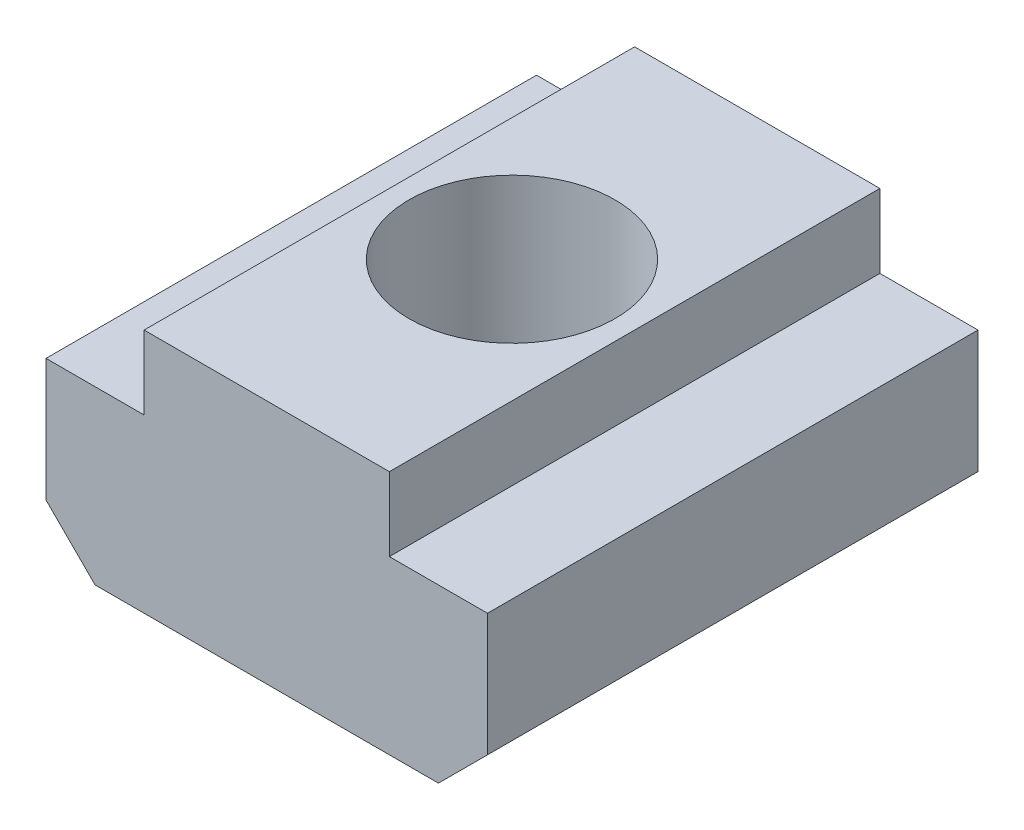
from build123d import *

# Parameters (mm, degrees)
BOSS_EXTRUDE1_DEPTH   = 10
M5X0_8_TAPPED_HOLE1_D = 4.2


with BuildPart() as part:
    # Sketch1 → Boss-Extrude1 (new body)
    with BuildSketch(Plane.XY):
        Polygon((-3.5, 0), (3.5, 0), (4.5, 1), (4.5, 3.5), (2.5, 3.5), (2.5, 5), (-2.5, 5), (-2.5, 3.5), (-4.5, 3.5), (-4.5, 1), align=None)
    extrude(amount=BOSS_EXTRUDE1_DEPTH)

    # M5x0.8 Tapped Hole1 (through all)
    with Locations(Plane(origin=(0, 5, 0), x_dir=(1, 0, 0), z_dir=(0, 1, 0))):
        with Locations((0, -5)):
            Hole(M5X0_8_TAPPED_HOLE1_D / 2)


solid = part.part
